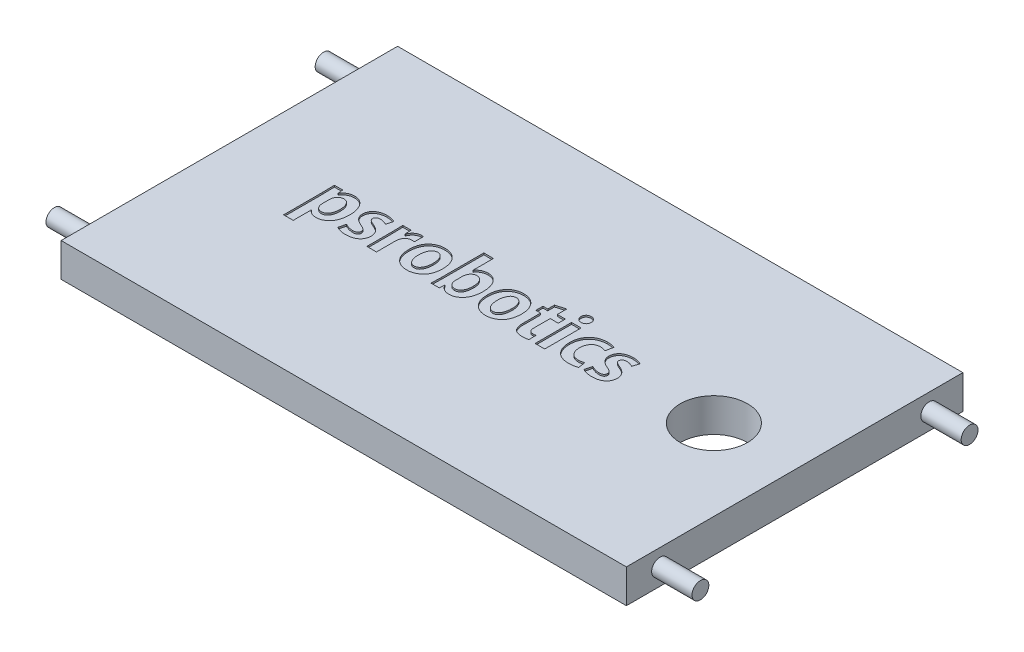
from build123d import *

# Parameters (mm, degrees)
SKETCH_1_W          = 168
SKETCH_1_H          = 100
EXTRUDE_1_DEPTH     = 10
SKETCH_2_R          = 2.5
EXTRUDE_2_DEPTH     = 12
EXTRUDE_START       = 12
SKETCH_3_R          = 2.5
EXTRUDE_3_DEPTH     = 12
SKETCH_4_R          = 10
CUT_EXTRUDE_1_DEPTH = 10
SKETCH_6_W          = 2.854406486
SKETCH_6_H          = 10.816518343
CUT_EXTRUDE_2_DEPTH = 0.5


with BuildPart() as part:
    # 草图1 → 凸台-拉伸1 (new body)
    with BuildSketch(Plane(origin=(0, 0, 0), x_dir=(1, 0, 0), z_dir=(0, 1, 0))):
        Rectangle(SKETCH_1_W, SKETCH_1_H)
    extrude(amount=EXTRUDE_1_DEPTH)

    # 草图2 → 凸台-拉伸2 (add)
    with BuildSketch(Plane.ZY.offset(84)):
        with Locations(Location((-40, 5, 0), (0, 0, 180))):
            Circle(SKETCH_2_R)
        with Locations(Location((40, 5, 0), (0, 0, 180))):
            Circle(SKETCH_2_R)
    extrude(amount=EXTRUDE_2_DEPTH)

    # 草图3 → 凸台-拉伸3 (add)
    with BuildSketch(Plane(origin=(84, 0, 0), x_dir=(0, 0, -1), z_dir=(1, 0, 0)).offset(EXTRUDE_START)):
        with Locations((-40, 5)):
            Circle(SKETCH_3_R)
        with Locations((40, 5)):
            Circle(SKETCH_3_R)
    extrude(amount=-EXTRUDE_3_DEPTH)

    # 草图4 → 切除-拉伸1 (cut)
    with BuildSketch(Plane(origin=(0, 10, 0), x_dir=(1, 0, 0), z_dir=(0, 1, 0))):
        with Locations(Location((60, 0, 0), (0, 0, 270))):
            Circle(SKETCH_4_R)
    extrude(amount=-CUT_EXTRUDE_1_DEPTH, mode=Mode.SUBTRACT)

    # 草图6 → 切除-拉伸2 (cut)
    # profile 1 of 11: a face of its own
    with BuildSketch(Plane(origin=(0, 10, 0), x_dir=(1, 0, 0), z_dir=(0, 1, 0))):
        with BuildLine():
            Line((-55.146102955, 4.84484548), (-57.634572767, 4.84484548))
            add(Edge.make_bspline(
                [(-57.634572767, 4.84484548), (-57.623966252, 4.587967633), (-57.6017651, 4.050280727), (-57.579946285, 3.204249915), (-57.566725529, 2.282686291), (-57.562102033, 1.642099097), (-57.559702503, 1.309643354)],
                knots=[0, 0, 0, 0, 0.872434831, 1.826147295, 2.87180102, 4, 4, 4, 4], degree=3))
            Line((-57.559702503, 1.309643354), (-57.556895795, -10.325331058))
            Line((-57.556895795, -10.325331058), (-54.702489308, -10.325331058))
            Line((-54.702489308, -10.325331058), (-54.702489308, -4.930150656))
            Line((-54.702489308, -4.930150656), (-54.663384692, -4.930150656))
            add(Edge.make_bspline(
                [(-54.663384692, -4.930150656), (-54.601309738, -5.021184105), (-54.475703882, -5.205386164), (-54.235616166, -5.447056322), (-53.956545152, -5.66016734), (-53.64640407, -5.852727572), (-53.299734659, -6.006912023), (-52.922114287, -6.119205332), (-52.514664988, -6.190542631), (-52.23234292, -6.202362093), (-52.086889027, -6.208451545)],
                knots=[0, 0, 0, 0, 0.880714621, 1.782086131, 2.711947099, 3.687971414, 4.6982148, 5.73955997, 6.83540878, 8, 8, 8, 8], degree=3))
            add(Edge.make_bspline(
                [(-52.086889027, -6.208451545), (-51.946196579, -6.204891175), (-51.667168075, -6.197830065), (-51.255184695, -6.134636526), (-50.856290682, -6.027954162), (-50.471937171, -5.873716887), (-50.098623707, -5.678903293), (-49.737872779, -5.438909097), (-49.392373978, -5.152834875), (-49.059423046, -4.826661531), (-48.747652471, -4.45511789), (-48.482127128, -4.025346462), (-48.250814624, -3.550009005), (-48.057153934, -3.026123236), (-47.906570745, -2.451869086), (-47.796899188, -1.829671549), (-47.719173064, -1.15884808), (-47.70185683, -0.694654663), (-47.692905312, -0.454692818)],
                knots=[0, 0, 0, 0, 0.833019025, 1.652086204, 2.462180915, 3.273926424, 4.100194538, 4.9525683, 5.835462923, 6.753389615, 7.710846528, 8.700498071, 9.737554625, 10.838085599, 12.00337457, 13.249274384, 14.578029827, 16, 16, 16, 16], degree=3))
            add(Edge.make_bspline(
                [(-47.692905312, -0.454692818), (-47.698729426, -0.24945429), (-47.710082113, 0.1506081), (-47.770211189, 0.734302373), (-47.861571988, 1.285520314), (-47.987411347, 1.804269024), (-48.14804649, 2.290043071), (-48.341258903, 2.745275316), (-48.572501019, 3.166706217), (-48.83280252, 3.555093388), (-49.121506339, 3.903791667), (-49.434449328, 4.208655254), (-49.767882257, 4.470491675), (-50.124017502, 4.684465052), (-50.500348602, 4.856311134), (-50.900683355, 4.974846018), (-51.320372055, 5.057461354), (-51.608880803, 5.070499121), (-51.755373632, 5.07711916)],
                knots=[0, 0, 0, 0, 1.287756241, 2.510166304, 3.677914371, 4.79081245, 5.855392705, 6.884510189, 7.888878388, 8.866584042, 9.813659286, 10.723557861, 11.602642665, 12.467156869, 13.324393567, 14.19046355, 15.081192111, 16, 16, 16, 16], degree=3))
            add(Edge.make_bspline(
                [(-51.755373632, 5.07711916), (-51.928027332, 5.070827076), (-52.265142094, 5.058541475), (-52.754171895, 4.973214679), (-53.208871772, 4.834210051), (-53.633973712, 4.650097689), (-54.020101342, 4.403672608), (-54.378034635, 4.112922805), (-54.702330218, 3.767455963), (-54.882869521, 3.503618975), (-54.975006201, 3.368972038)],
                knots=[0, 0, 0, 0, 1.086953167, 2.122329029, 3.114714223, 4.075679785, 5.029526715, 5.989188732, 6.973799774, 8, 8, 8, 8], degree=3))
            Line((-54.975006201, 3.368972038), (-55.011090106, 3.368983013))
            Line((-55.011090106, 3.368983013), (-55.146102955, 4.84484548))
        make_face()
        with BuildLine():
            add(Edge.make_bspline(
                [(-54.702489308, 0.41904691), (-54.694123519, 0.579035622), (-54.677910689, 0.88909241), (-54.560220502, 1.330928353), (-54.384636809, 1.733414812), (-54.17792372, 2.02815126), (-53.987291918, 2.235314332), (-53.832410406, 2.370595326), (-53.667706371, 2.485570099), (-53.497206889, 2.587383899), (-53.31170376, 2.657885305), (-53.1205299, 2.715390511), (-52.919807705, 2.752508688), (-52.782843617, 2.760757333), (-52.713396935, 2.76493975)],
                knots=[0, 0, 0, 0, 1.686726831, 3.268862506, 4.795218998, 6.300437724, 7.041767852, 7.763265046, 8.465273548, 9.160360029, 9.852277247, 10.552823157, 11.266219121, 12, 12, 12, 12], degree=3))
            add(Edge.make_bspline(
                [(-52.713396935, 2.76493975), (-52.627016457, 2.760493022), (-52.457645111, 2.751774057), (-52.212140339, 2.7031412), (-51.982435625, 2.627370617), (-51.769418556, 2.522688918), (-51.574940171, 2.388895071), (-51.394440472, 2.230264817), (-51.235740247, 2.039319692), (-51.089591792, 1.825992151), (-50.960939955, 1.590530184), (-50.852148729, 1.334666192), (-50.755322525, 1.063264856), (-50.681922228, 0.771998095), (-50.618116721, 0.465933832), (-50.577941149, 0.141774542), (-50.55170392, -0.199529323), (-50.548800021, -0.433100088), (-50.547309056, -0.553023656)],
                knots=[0, 0, 0, 0, 0.935867529, 1.835011164, 2.701048921, 3.549322375, 4.396139147, 5.25111747, 6.143369254, 7.077421111, 8.048836738, 9.043745302, 10.086321518, 11.16636512, 12.294263889, 13.470607517, 14.701319613, 16, 16, 16, 16], degree=3))
            add(Edge.make_bspline(
                [(-50.547309056, -0.553023656), (-50.548943637, -0.673864441), (-50.552140517, -0.910202312), (-50.576558347, -1.255625657), (-50.622576383, -1.583718128), (-50.682931903, -1.894638611), (-50.762829149, -2.18904017), (-50.856149771, -2.46735785), (-50.97296818, -2.726807509), (-51.103821621, -2.968252959), (-51.250561589, -3.188140527), (-51.419112112, -3.378420366), (-51.602036614, -3.542844587), (-51.802568973, -3.679811198), (-52.022532706, -3.783085804), (-52.256552525, -3.863657765), (-52.509395828, -3.910429616), (-52.683255584, -3.921500133), (-52.772395438, -3.927176112)],
                knots=[0, 0, 0, 0, 1.283057567, 2.509377056, 3.673742815, 4.798940461, 5.869887558, 6.910729667, 7.912262172, 8.886775332, 9.82447372, 10.712177734, 11.578403903, 12.43059094, 13.280047066, 14.15105402, 15.052024584, 16, 16, 16, 16], degree=3))
            add(Edge.make_bspline(
                [(-52.772395438, -3.927176112), (-52.8959997, -3.921666686), (-53.140846429, -3.910753106), (-53.491748406, -3.793245235), (-53.82047427, -3.613207704), (-54.06527619, -3.402591591), (-54.243062951, -3.202149989), (-54.358694824, -3.027053097), (-54.460349507, -2.835558474), (-54.544760692, -2.624713464), (-54.607737202, -2.394276279), (-54.659892525, -2.14692862), (-54.688714671, -1.879672654), (-54.697812348, -1.695585483), (-54.702489308, -1.60094944)],
                knots=[0, 0, 0, 0, 1.310090046, 2.595147259, 3.892303463, 5.277140479, 6.004146831, 6.736115741, 7.502375817, 8.306837944, 9.145406286, 10.039943247, 10.992368591, 12, 12, 12, 12], degree=3))
            Line((-54.702489308, -1.60094944), (-54.702489308, 0.41904691))
        make_face(mode=Mode.SUBTRACT)
    # profile 2 of 11: a face of its own
    with BuildSketch(Plane(origin=(0, 10, 0), x_dir=(1, 0, 0), z_dir=(0, 1, 0))):
        with BuildLine():
            add(Edge.make_bspline(
                [(-46.3018285, -5.481818481), (-46.207573439, -5.537115402), (-46.012966911, -5.651285843), (-45.690343166, -5.782928621), (-45.34288352, -5.909897871), (-44.96668849, -6.013400327), (-44.569488644, -6.1015059), (-44.156379406, -6.162366506), (-43.730376488, -6.199360996), (-43.442278373, -6.205391816), (-43.296112145, -6.208451545)],
                knots=[0, 0, 0, 0, 0.83761196, 1.729400559, 2.668252281, 3.676193025, 4.720774259, 5.789020092, 6.87826204, 8, 8, 8, 8], degree=3))
            add(Edge.make_bspline(
                [(-43.296112145, -6.208451545), (-43.13023167, -6.204089282), (-42.80808816, -6.195617671), (-42.339715674, -6.147013612), (-41.900999275, -6.072445969), (-41.491942705, -5.969084067), (-41.112948423, -5.836679905), (-40.76318043, -5.677133311), (-40.44351928, -5.488352539), (-40.155369784, -5.271200692), (-39.901045715, -5.029259557), (-39.674764899, -4.770321817), (-39.489881, -4.485784031), (-39.333705975, -4.184305356), (-39.212079718, -3.86087702), (-39.126355475, -3.517713557), (-39.071091951, -3.154461856), (-39.063401251, -2.90567694), (-39.05945777, -2.778110039)],
                knots=[0, 0, 0, 0, 1.294448016, 2.513846346, 3.670773034, 4.764320961, 5.802019244, 6.79930617, 7.759297293, 8.693207164, 9.608170021, 10.494314425, 11.369880064, 12.249036721, 13.139389433, 14.05924175, 15.004857203, 16, 16, 16, 16], degree=3))
            add(Edge.make_bspline(
                [(-39.05945777, -2.778110039), (-39.059692717, -2.688143549), (-39.060154098, -2.511470161), (-39.089014716, -2.249902515), (-39.141382675, -1.998087415), (-39.205252242, -1.751575725), (-39.302524263, -1.51823418), (-39.409256617, -1.2893969), (-39.543318307, -1.071758849), (-39.699514443, -0.863914949), (-39.872497811, -0.661453957), (-40.068326028, -0.469198148), (-40.285248258, -0.287344759), (-40.522157311, -0.112062115), (-40.781036627, 0.052666201), (-41.060234758, 0.210687763), (-41.360603871, 0.359318016), (-41.570655694, 0.449084655), (-41.677867503, 0.494902128)],
                knots=[0, 0, 0, 0, 0.962486949, 1.890101854, 2.810103424, 3.714741646, 4.610057768, 5.511190598, 6.415440003, 7.339636668, 8.292049338, 9.263110372, 10.273172223, 11.319680428, 12.415205866, 13.555314351, 14.752216631, 16, 16, 16, 16], degree=3))
            add(Edge.make_bspline(
                [(-41.677867503, 0.494902128), (-41.824470059, 0.555481815), (-42.095726949, 0.667571658), (-42.465114637, 0.840741044), (-42.762145419, 1.008700875), (-43.00022991, 1.164698384), (-43.173978575, 1.333493736), (-43.297160029, 1.513736943), (-43.36904449, 1.713659859), (-43.372855793, 1.852250007), (-43.374776815, 1.922103999)],
                knots=[0, 0, 0, 0, 1.614286799, 2.986894832, 4.147698299, 5.086165248, 5.874638583, 6.596229827, 7.29245366, 8, 8, 8, 8], degree=3))
            add(Edge.make_bspline(
                [(-43.374776815, 1.922103999), (-43.370377079, 1.992815058), (-43.3617347, 2.13171243), (-43.295585252, 2.330305232), (-43.18137361, 2.506378686), (-43.024565877, 2.659672006), (-42.823738798, 2.782929108), (-42.583868017, 2.877520054), (-42.301621754, 2.927060259), (-42.101321839, 2.936787964), (-41.995335636, 2.941935258)],
                knots=[0, 0, 0, 0, 0.881322943, 1.731178161, 2.577168917, 3.477799905, 4.443891127, 5.498430146, 6.676325488, 8, 8, 8, 8], degree=3))
            add(Edge.make_bspline(
                [(-41.995335636, 2.941935258), (-41.895090203, 2.937300515), (-41.696917337, 2.928138201), (-41.405712784, 2.897644433), (-41.128000517, 2.834796926), (-40.862743811, 2.761668942), (-40.616063022, 2.668629612), (-40.385151541, 2.582408793), (-40.178688608, 2.48551649), (-40.050889173, 2.416208309), (-39.989386549, 2.38285421)],
                knots=[0, 0, 0, 0, 1.145139439, 2.263799542, 3.334746207, 4.390066399, 5.400675127, 6.341237668, 7.2017317, 8, 8, 8, 8], degree=3))
            Line((-39.989386549, 2.38285421), (-39.457812894, 4.328339709))
            add(Edge.make_bspline(
                [(-39.457812894, 4.328339709), (-39.539067997, 4.367203566), (-39.707563869, 4.447794191), (-39.978457958, 4.554958098), (-40.276801527, 4.648326424), (-40.598308743, 4.736777653), (-40.943642671, 4.806663518), (-41.310675136, 4.855639701), (-41.696838561, 4.891522596), (-41.961535277, 4.89535862), (-42.096475926, 4.8973142)],
                knots=[0, 0, 0, 0, 0.793782206, 1.646038456, 2.564925853, 3.548079898, 4.584144923, 5.667469512, 6.810891258, 8, 8, 8, 8], degree=3))
            add(Edge.make_bspline(
                [(-42.096475926, 4.8973142), (-42.245543248, 4.893207653), (-42.537041963, 4.885177368), (-42.961129586, 4.832277745), (-43.360404353, 4.757917518), (-43.736074955, 4.656730937), (-44.086454317, 4.525809975), (-44.41133563, 4.364356813), (-44.711997139, 4.177868882), (-44.986621546, 3.965695284), (-45.231052324, 3.728866501), (-45.446006548, 3.474994968), (-45.630311836, 3.204555539), (-45.780139525, 2.914664382), (-45.898381402, 2.608568438), (-45.982474028, 2.284238531), (-46.036696104, 1.944461298), (-46.046970147, 1.711595951), (-46.05218505, 1.593398056)],
                knots=[0, 0, 0, 0, 1.238305518, 2.421486237, 3.5461187, 4.61066152, 5.649707088, 6.648348897, 7.619889882, 8.584803378, 9.525735187, 10.442256057, 11.344296488, 12.23865353, 13.147513515, 14.064694656, 15.017676866, 16, 16, 16, 16], degree=3))
            add(Edge.make_bspline(
                [(-46.05218505, 1.593398056), (-46.046601535, 1.445632764), (-46.035444536, 1.150367635), (-45.915160688, 0.713622981), (-45.718966083, 0.290122783), (-45.491682121, -0.048048694), (-45.269111075, -0.308856033), (-45.06916273, -0.499618935), (-44.848222101, -0.689491511), (-44.595019116, -0.868146296), (-44.319023843, -1.044514694), (-44.015705352, -1.213578557), (-43.68670984, -1.376970816), (-43.454888357, -1.476580636), (-43.33544448, -1.527903675)],
                knots=[0, 0, 0, 0, 1.205031059, 2.40789731, 3.671482689, 5.006580914, 5.722947508, 6.46981472, 7.262559811, 8.101501413, 8.999551731, 9.938382947, 10.93777087, 12, 12, 12, 12], degree=3))
            add(Edge.make_bspline(
                [(-43.33544448, -1.527903675), (-43.196091014, -1.585169607), (-42.936629787, -1.69179264), (-42.586592778, -1.865184665), (-42.303220462, -2.035172276), (-42.079960583, -2.204164581), (-41.919406112, -2.387866922), (-41.804101597, -2.583796607), (-41.740575919, -2.801351887), (-41.738113062, -2.951914582), (-41.736866006, -3.028151311)],
                knots=[0, 0, 0, 0, 1.539706787, 2.866769117, 3.98803217, 4.914911995, 5.715441686, 6.465811877, 7.223170887, 8, 8, 8, 8], degree=3))
            add(Edge.make_bspline(
                [(-41.736866006, -3.028151311), (-41.740510269, -3.10740313), (-41.747527952, -3.260016709), (-41.821501702, -3.476916294), (-41.945262713, -3.66489668), (-42.116325887, -3.826893912), (-42.337605071, -3.95354286), (-42.608093698, -4.041170633), (-42.925792571, -4.097303785), (-43.154432932, -4.103613772), (-43.276445977, -4.106981073)],
                knots=[0, 0, 0, 0, 0.894036243, 1.721627017, 2.5562417, 3.418119501, 4.363067525, 5.415159204, 6.6206097, 8, 8, 8, 8], degree=3))
            add(Edge.make_bspline(
                [(-43.276445977, -4.106981073), (-43.390848639, -4.102260759), (-43.61951598, -4.092825825), (-43.962028194, -4.045372019), (-44.305337291, -3.976736695), (-44.641672659, -3.877359678), (-44.963136489, -3.767293154), (-45.257820992, -3.648666495), (-45.524094793, -3.530225248), (-45.6856777, -3.439498977), (-45.762811443, -3.396189589)],
                knots=[0, 0, 0, 0, 1.051998463, 2.102728099, 3.174823593, 4.267460494, 5.323782618, 6.297336217, 7.187210868, 8, 8, 8, 8], degree=3))
            Line((-45.762811443, -3.396189589), (-46.3018285, -5.481818481))
        make_face()
    # profile 3 of 11: a face of its own
    with BuildSketch(Plane(origin=(0, 10, 0), x_dir=(1, 0, 0), z_dir=(0, 1, 0))):
        with BuildLine():
            Line((-34.571187293, 2.832536714), (-34.686912592, 4.672558))
            Line((-34.686912592, 4.672558), (-37.136807303, 4.672558))
            add(Edge.make_bspline(
                [(-37.136807303, 4.672558), (-37.127486042, 4.428144717), (-37.108166626, 3.921569306), (-37.088236377, 3.276294329), (-37.071301934, 2.728489485), (-37.068262616, 2.289195983), (-37.060223857, 1.826606108), (-37.061355915, 1.510991545), (-37.06193704, 1.348975689)],
                knots=[0, 0, 0, 0, 1.324207679, 2.744576904, 3.495229973, 4.291304775, 5.122867722, 6, 6, 6, 6], degree=3))
            Line((-37.06193704, 1.348975689), (-37.059130331, -6.085916616))
            Line((-37.059130331, -6.085916616), (-34.204723844, -6.085916616))
            Line((-34.204723844, -6.085916616), (-34.204723844, -0.493174636))
            add(Edge.make_bspline(
                [(-34.204723844, -0.493174636), (-34.201568548, -0.38192841), (-34.195448005, -0.16613659), (-34.161472684, 0.146284551), (-34.108734386, 0.436631196), (-34.036579012, 0.7050733), (-33.942138646, 0.950468751), (-33.835617743, 1.177632806), (-33.700123463, 1.377618457), (-33.552267528, 1.559244171), (-33.385743235, 1.714894958), (-33.209818102, 1.852833401), (-33.021190328, 1.966589958), (-32.82300244, 2.064700111), (-32.61135898, 2.137347313), (-32.388807826, 2.186534053), (-32.155759027, 2.219723637), (-31.996615241, 2.221701394), (-31.915020054, 2.222715417)],
                knots=[0, 0, 0, 0, 1.328993375, 2.577938255, 3.749595128, 4.851401761, 5.892294362, 6.887899519, 7.84040204, 8.769965346, 9.679936652, 10.557066843, 11.435764995, 12.306307666, 13.19428498, 14.100673707, 15.026189549, 16, 16, 16, 16], degree=3))
            add(Edge.make_bspline(
                [(-31.915020054, 2.222715417), (-31.781789479, 2.221178059), (-31.534233283, 2.21832149), (-31.289264675, 2.18288947), (-31.176134046, 2.166526367)],
                knots=[0, 0, 0, 0, 1.076366321, 2, 2, 2, 2], degree=3))
            Line((-31.176134046, 2.166526367), (-31.175321939, 4.843281624))
            add(Edge.make_bspline(
                [(-31.175321939, 4.843281624), (-31.27276079, 4.860091791), (-31.484897986, 4.896689734), (-31.700251742, 4.897095052), (-31.816689217, 4.8973142)],
                knots=[0, 0, 0, 0, 0.918639949, 2, 2, 2, 2], degree=3))
            add(Edge.make_bspline(
                [(-31.816689217, 4.8973142), (-31.947393181, 4.890287078), (-32.210336499, 4.876150287), (-32.601077428, 4.776726217), (-32.983613081, 4.609107659), (-33.358785504, 4.383515256), (-33.711257218, 4.092321762), (-34.019535811, 3.730256879), (-34.290073554, 3.309663704), (-34.424656947, 2.994816949), (-34.494097452, 2.83236661)],
                knots=[0, 0, 0, 0, 0.873024494, 1.756304479, 2.675727742, 3.655517484, 4.673026258, 5.715548879, 6.821300036, 8, 8, 8, 8], degree=3))
            Line((-34.494097452, 2.83236661), (-34.571187293, 2.832536714))
        make_face()
    # profile 4 of 11: a face of its own
    with BuildSketch(Plane(origin=(0, 10, 0), x_dir=(1, 0, 0), z_dir=(0, 1, 0))):
        with BuildLine():
            add(Edge.make_bspline(
                [(-24.924073374, 5.070682661), (-25.109146398, 5.065012548), (-25.471972581, 5.053896582), (-26.001968875, 4.979446465), (-26.503852102, 4.861046303), (-26.981253388, 4.702326703), (-27.427897949, 4.48924872), (-27.850124981, 4.235052866), (-28.245782493, 3.935838319), (-28.610746997, 3.590382334), (-28.940020123, 3.201014419), (-29.231323891, 2.772738185), (-29.4766429, 2.301737569), (-29.677452398, 1.791799042), (-29.839504203, 1.243071754), (-29.950902385, 0.652770463), (-30.029701303, 0.024015112), (-30.042819592, -0.40948867), (-30.049543592, -0.631688326)],
                knots=[0, 0, 0, 0, 1.027541305, 2.01444209, 2.965455667, 3.887964877, 4.802126615, 5.70729655, 6.620422444, 7.551044475, 8.491838489, 9.446611953, 10.4211747, 11.434103498, 12.48554143, 13.593051636, 14.766278128, 16, 16, 16, 16], degree=3))
            add(Edge.make_bspline(
                [(-30.049543592, -0.631688326), (-30.04220898, -0.847268187), (-30.0279165, -1.26735456), (-29.957654371, -1.878013311), (-29.846348104, -2.451540454), (-29.691232465, -2.987143449), (-29.498748821, -3.487036487), (-29.261962009, -3.948020689), (-28.981802077, -4.369960281), (-28.661585813, -4.751831484), (-28.306136059, -5.092181563), (-27.924177684, -5.391484474), (-27.512511866, -5.644701879), (-27.071997709, -5.848072493), (-26.605547824, -6.014756958), (-26.109043294, -6.125767586), (-25.586782701, -6.203132112), (-25.228820371, -6.212230702), (-25.045908684, -6.216879902)],
                knots=[0, 0, 0, 0, 1.223897542, 2.384929084, 3.484665604, 4.536017932, 5.545769523, 6.520427524, 7.47127239, 8.414510255, 9.343031883, 10.259533357, 11.163839298, 12.079307538, 13.00892387, 13.969450143, 14.96242909, 16, 16, 16, 16], degree=3))
            add(Edge.make_bspline(
                [(-25.045908684, -6.216879902), (-24.887499491, -6.215135633), (-24.573366557, -6.211676663), (-24.108097028, -6.154908221), (-23.656653984, -6.051415615), (-23.216643363, -5.913208722), (-22.791337123, -5.724148883), (-22.379441441, -5.49334478), (-21.977884299, -5.222315096), (-21.592933588, -4.90883501), (-21.233025658, -4.547704002), (-20.919046506, -4.126563474), (-20.653018659, -3.651484404), (-20.429949987, -3.123889511), (-20.254319288, -2.54251079), (-20.125084555, -1.907521064), (-20.032611868, -1.220422034), (-20.01305343, -0.743440704), (-20.002941441, -0.496834606)],
                knots=[0, 0, 0, 0, 0.884174072, 1.753359075, 2.610998878, 3.46768153, 4.324683351, 5.204936043, 6.101305348, 7.026692402, 7.9733639, 8.940823434, 9.950119057, 11.006907355, 12.133439191, 13.335476165, 14.622403465, 16, 16, 16, 16], degree=3))
            add(Edge.make_bspline(
                [(-20.002941441, -0.496834606), (-20.008338441, -0.292498878), (-20.018862681, 0.105959152), (-20.085113311, 0.688164996), (-20.187526276, 1.238899808), (-20.330240046, 1.759489327), (-20.516565535, 2.247305888), (-20.741640703, 2.704901175), (-21.007082313, 3.131169095), (-21.309560818, 3.525090179), (-21.649716178, 3.879275636), (-22.021812741, 4.190831865), (-22.427709644, 4.454374141), (-22.865597731, 4.670642594), (-23.335144621, 4.843928811), (-23.837833735, 4.965168983), (-24.37103245, 5.045735307), (-24.737510834, 5.060918761), (-24.925102226, 5.068690803)],
                knots=[0, 0, 0, 0, 1.172178488, 2.285767329, 3.357353606, 4.383142343, 5.37790515, 6.348569651, 7.304145378, 8.254071287, 9.192580156, 10.115693567, 11.032123006, 11.961934424, 12.912057809, 13.897126048, 14.92358985, 16, 16, 16, 16], degree=3))
            Line((-24.925102226, 5.068690803), (-24.924073374, 5.070682661))
        make_face()
        with BuildLine():
            add(Edge.make_bspline(
                [(-22.854538475, -0.553081272), (-22.856903184, -0.675807922), (-22.861512816, -0.915044414), (-22.891410629, -1.265499989), (-22.931950115, -1.599611209), (-22.990973916, -1.919805686), (-23.069032018, -2.22487258), (-23.165941707, -2.515006691), (-23.273601172, -2.791733112), (-23.402548503, -3.049306563), (-23.547473897, -3.285006269), (-23.707232605, -3.494301504), (-23.882545461, -3.674130037), (-24.075356608, -3.822185157), (-24.286159601, -3.938115746), (-24.511769776, -4.025503962), (-24.752901814, -4.083270196), (-24.919170111, -4.095261188), (-25.003766896, -4.101362168)],
                knots=[0, 0, 0, 0, 1.283122856, 2.501248181, 3.675693063, 4.801111487, 5.90306991, 6.965153204, 7.997944625, 9.005120804, 9.972479457, 10.88710922, 11.752618092, 12.590832926, 13.419210094, 14.259310164, 15.114342493, 16, 16, 16, 16], degree=3))
            add(Edge.make_bspline(
                [(-25.003766896, -4.101362168), (-25.091109267, -4.095013038), (-25.261695927, -4.082612679), (-25.510006746, -4.029031196), (-25.740410321, -3.94162897), (-25.954093498, -3.824055837), (-26.152913467, -3.680287614), (-26.333714956, -3.503719754), (-26.497399694, -3.296671514), (-26.641749806, -3.060572004), (-26.768540826, -2.802356893), (-26.885051744, -2.53045043), (-26.981612893, -2.241218468), (-27.054393184, -1.935908052), (-27.117862693, -1.616637418), (-27.162520098, -1.282681067), (-27.187610385, -0.932694231), (-27.190733695, -0.694473363), (-27.192330396, -0.572689824)],
                knots=[0, 0, 0, 0, 0.911055033, 1.779363595, 2.63415358, 3.467599306, 4.312094286, 5.180950159, 6.090072498, 7.053374358, 8.056326761, 9.083167907, 10.131542306, 11.226494184, 12.349015479, 13.51979452, 14.732066572, 16, 16, 16, 16], degree=3))
            add(Edge.make_bspline(
                [(-27.192330396, -0.572689824), (-27.18860646, -0.359796389), (-27.181270747, 0.05957848), (-27.089581617, 0.673407785), (-26.93392501, 1.258915091), (-26.751983995, 1.720137252), (-26.571147884, 2.062014415), (-26.409443776, 2.28500502), (-26.228420122, 2.480271504), (-26.022176219, 2.640662965), (-25.793762171, 2.769027327), (-25.543797806, 2.864193885), (-25.2719705, 2.930837454), (-25.081884759, 2.945586073), (-24.984100729, 2.953173068)],
                knots=[0, 0, 0, 0, 1.65391609, 3.258018954, 4.81028456, 6.355517439, 7.101557024, 7.81077486, 8.490611841, 9.164890731, 9.833129237, 10.519947043, 11.238630196, 12, 12, 12, 12], degree=3))
            add(Edge.make_bspline(
                [(-24.984100729, 2.953173068), (-24.892886091, 2.945386979), (-24.716009701, 2.930288795), (-24.461913267, 2.866305618), (-24.227066364, 2.773877082), (-24.010054456, 2.649273427), (-23.816102529, 2.489618552), (-23.639096357, 2.301135591), (-23.482135245, 2.082050881), (-23.303113324, 1.745190504), (-23.121176702, 1.287887343), (-22.961615427, 0.70387801), (-22.871795493, 0.084737601), (-22.86223163, -0.339220847), (-22.857345184, -0.555833109)],
                knots=[0, 0, 0, 0, 0.723780441, 1.403499192, 2.065726992, 2.716821306, 3.375678756, 4.047057085, 4.75896833, 5.502158925, 7.062054522, 8.644794005, 10.285731159, 12, 12, 12, 12], degree=3))
            Line((-22.857345184, -0.555833109), (-22.854538475, -0.553081272))
        make_face(mode=Mode.SUBTRACT)
    # profile 5 of 11: a face of its own
    with BuildSketch(Plane(origin=(0, 10, 0), x_dir=(1, 0, 0), z_dir=(0, 1, 0))):
        with BuildLine():
            Line((-15.145398063, 9.631688876), (-17.99980455, 9.631688876))
            Line((-17.99980455, 9.631688876), (-17.99980455, -2.889950392))
            add(Edge.make_bspline(
                [(-17.99980455, -2.889950392), (-18.001958302, -3.172020573), (-18.006236163, -3.732278585), (-18.021139662, -4.426369049), (-18.035072333, -4.962063273), (-18.050008368, -5.333790657), (-18.063716333, -5.676558399), (-18.0736916, -5.895669717), (-18.078466476, -6.00055206)],
                knots=[0, 0, 0, 0, 1.631623893, 3.240790478, 4.015719323, 4.731271361, 5.392695757, 6, 6, 6, 6], degree=3))
            Line((-18.078466476, -6.00055206), (-15.64687436, -5.999937492))
            Line((-15.64687436, -5.999937492), (-15.511861511, -4.504655782))
            Line((-15.511861511, -4.504655782), (-15.453998861, -4.504655782))
            add(Edge.make_bspline(
                [(-15.453998861, -4.504655782), (-15.367056837, -4.649066011), (-15.19942851, -4.927495751), (-14.894970295, -5.290412669), (-14.563433337, -5.591636869), (-14.199220599, -5.826013581), (-13.811664966, -6.003922518), (-13.402293886, -6.127682991), (-12.97274701, -6.202916978), (-12.679007555, -6.210313344), (-12.529797782, -6.21407045)],
                knots=[0, 0, 0, 0, 1.131380875, 2.181355746, 3.170752353, 4.130871389, 5.079890649, 6.027531582, 6.998052322, 8, 8, 8, 8], degree=3))
            add(Edge.make_bspline(
                [(-12.529797782, -6.21407045), (-12.387242459, -6.209475186), (-12.104411307, -6.200358137), (-11.687098392, -6.135871377), (-11.284379233, -6.021166593), (-10.895583406, -5.864146576), (-10.520921859, -5.658859695), (-10.16207814, -5.408182797), (-9.816580628, -5.112101571), (-9.485823031, -4.774715894), (-9.180582258, -4.388599322), (-8.913670692, -3.953639637), (-8.685502963, -3.470946871), (-8.49518439, -2.94329717), (-8.347497652, -2.367174161), (-8.236133315, -1.746546968), (-8.163228905, -1.078086983), (-8.145146963, -0.616884655), (-8.135814067, -0.378837601)],
                knots=[0, 0, 0, 0, 0.838392905, 1.663379705, 2.475971964, 3.296293461, 4.124491874, 4.983210998, 5.866229662, 6.797166972, 7.758061466, 8.75472666, 9.791965596, 10.893148678, 12.048777793, 13.28585033, 14.599106523, 16, 16, 16, 16], degree=3))
            add(Edge.make_bspline(
                [(-8.135814067, -0.378837601), (-8.140978203, -0.178314136), (-8.151034995, 0.212191232), (-8.204616111, 0.782875404), (-8.291130535, 1.32156919), (-8.408662724, 1.830921134), (-8.559816206, 2.309549192), (-8.744888934, 2.757127326), (-8.963137316, 3.173026281), (-9.208125575, 3.557390856), (-9.482877775, 3.904105612), (-9.784757103, 4.206483022), (-10.109724296, 4.464388531), (-10.458290757, 4.678009341), (-10.832184037, 4.843211136), (-11.227344273, 4.968456207), (-11.647560909, 5.045340677), (-11.93575042, 5.058932285), (-12.083094834, 5.06588135)],
                knots=[0, 0, 0, 0, 1.28131298, 2.495267064, 3.658931251, 4.76484831, 5.832085595, 6.862128514, 7.85502597, 8.829269738, 9.770241519, 10.675634193, 11.55307539, 12.415039348, 13.280133321, 14.158186302, 15.058324646, 16, 16, 16, 16], degree=3))
            add(Edge.make_bspline(
                [(-12.083094834, 5.06588135), (-12.251002124, 5.060115166), (-12.576422975, 5.048939733), (-13.047813292, 4.97328481), (-13.482806827, 4.843759573), (-13.882917523, 4.665404002), (-14.24542354, 4.44288739), (-14.574225493, 4.181034454), (-14.865207608, 3.877250968), (-15.027371652, 3.647428757), (-15.10887518, 3.531920284)],
                knots=[0, 0, 0, 0, 1.137196293, 2.203998325, 3.223492524, 4.203095137, 5.162612269, 6.096781389, 7.043443732, 8, 8, 8, 8], degree=3))
            Line((-15.10887518, 3.531920284), (-15.145398063, 3.534046578))
            Line((-15.145398063, 3.534046578), (-15.145398063, 9.631688876))
        make_face()
        with BuildLine():
            add(Edge.make_bspline(
                [(-15.145398063, 0.440123291), (-15.14078658, 0.526818437), (-15.131812355, 0.695532424), (-15.101778156, 0.942474443), (-15.051152867, 1.1754946), (-14.982970444, 1.394820537), (-14.902875962, 1.602311179), (-14.800494547, 1.793622519), (-14.682358223, 1.971847826), (-14.504674127, 2.185270848), (-14.258272103, 2.41195308), (-13.929521608, 2.619166207), (-13.570283893, 2.744207981), (-13.321110403, 2.765470652), (-13.195638026, 2.77617756)],
                knots=[0, 0, 0, 0, 0.926973479, 1.803946349, 2.653285131, 3.46941656, 4.254951615, 5.024407706, 5.781613554, 6.534514615, 7.985556617, 9.337145824, 10.65910838, 12, 12, 12, 12], degree=3))
            add(Edge.make_bspline(
                [(-13.195638026, 2.77617756), (-13.105442048, 2.771025134), (-12.930228534, 2.761016098), (-12.677292423, 2.707315815), (-12.439474679, 2.634471711), (-12.222189229, 2.525591459), (-12.022291344, 2.39127667), (-11.838628585, 2.231083772), (-11.674801324, 2.039928839), (-11.52991599, 1.822898814), (-11.401512631, 1.585598683), (-11.293348366, 1.330522317), (-11.194978344, 1.062561304), (-11.121584219, 0.77601292), (-11.062207206, 0.474932672), (-11.020516237, 0.158715972), (-10.994763118, -0.173315204), (-10.991756455, -0.400328048), (-10.990217811, -0.516500774)],
                knots=[0, 0, 0, 0, 0.976076565, 1.896113425, 2.790116899, 3.660142464, 4.514449837, 5.390414213, 6.288313643, 7.229749571, 8.209028891, 9.202876975, 10.225239958, 11.294334228, 12.39917788, 13.544132677, 14.743221774, 16, 16, 16, 16], degree=3))
            add(Edge.make_bspline(
                [(-10.990217811, -0.516500774), (-10.993102532, -0.645750054), (-10.998710107, -0.8969961), (-11.021192077, -1.264249015), (-11.071278044, -1.607844527), (-11.13040811, -1.931620405), (-11.214516155, -2.231682114), (-11.305445606, -2.51450338), (-11.427353451, -2.770389866), (-11.556931104, -3.007486972), (-11.705724992, -3.219595496), (-11.873388577, -3.403779272), (-12.055046426, -3.562603146), (-12.255159801, -3.689281417), (-12.467400067, -3.793052612), (-12.69692533, -3.863975995), (-12.940570966, -3.915211695), (-13.109199551, -3.921264177), (-13.195638026, -3.92436666)],
                knots=[0, 0, 0, 0, 1.364917333, 2.653245589, 3.88085136, 5.028713805, 6.124739769, 7.168976952, 8.159854234, 9.111483112, 10.019432624, 10.88731207, 11.735541447, 12.558266628, 13.380754164, 14.221808758, 15.088504847, 16, 16, 16, 16], degree=3))
            add(Edge.make_bspline(
                [(-13.195638026, -3.92436666), (-13.266939304, -3.92001672), (-13.406508496, -3.911501899), (-13.610827664, -3.877321339), (-13.804412525, -3.825095446), (-13.986752671, -3.750288061), (-14.158842091, -3.657972753), (-14.318910556, -3.544390334), (-14.469619767, -3.414576426), (-14.652171741, -3.215092547), (-14.847998639, -2.932520639), (-15.018220822, -2.55069235), (-15.1209375, -2.129683531), (-15.137068201, -1.836587319), (-15.145398063, -1.685233015)],
                knots=[0, 0, 0, 0, 0.777325877, 1.521582024, 2.25130851, 2.955661787, 3.662813928, 4.372827115, 5.088382805, 5.824351233, 7.312060107, 8.809069102, 10.352209605, 12, 12, 12, 12], degree=3))
            Line((-15.145398063, -1.685233015), (-15.145398063, 0.440123291))
        make_face(mode=Mode.SUBTRACT)
    # profile 6 of 11: a face of its own
    with BuildSketch(Plane(origin=(0, 10, 0), x_dir=(1, 0, 0), z_dir=(0, 1, 0))):
        with BuildLine():
            add(Edge.make_bspline(
                [(-1.549428548, 5.070682661), (-1.734501572, 5.065012548), (-2.097327754, 5.053896582), (-2.627324049, 4.979446465), (-3.129207275, 4.861046303), (-3.606608561, 4.702326703), (-4.053253123, 4.48924872), (-4.475480154, 4.235052866), (-4.871137667, 3.935838319), (-5.236102171, 3.590382334), (-5.565375297, 3.201014419), (-5.856679064, 2.772738185), (-6.101998073, 2.301737569), (-6.302807571, 1.791799042), (-6.464859377, 1.243071754), (-6.576257559, 0.652770463), (-6.655056476, 0.024015112), (-6.668174766, -0.40948867), (-6.674898766, -0.631688326)],
                knots=[0, 0, 0, 0, 1.027541305, 2.01444209, 2.965455667, 3.887964877, 4.802126615, 5.70729655, 6.620422444, 7.551044475, 8.491838489, 9.446611953, 10.4211747, 11.434103498, 12.48554143, 13.593051636, 14.766278128, 16, 16, 16, 16], degree=3))
            add(Edge.make_bspline(
                [(-6.674898766, -0.631688326), (-6.667564153, -0.847268187), (-6.653271673, -1.26735456), (-6.583009544, -1.878013311), (-6.471703278, -2.451540454), (-6.316587639, -2.987143449), (-6.124103995, -3.487036487), (-5.887317182, -3.948020689), (-5.60715725, -4.369960281), (-5.286940986, -4.751831484), (-4.931491233, -5.092181563), (-4.549532858, -5.391484474), (-4.137867039, -5.644701879), (-3.697352883, -5.848072493), (-3.230902997, -6.014756958), (-2.734398468, -6.125767586), (-2.212137875, -6.203132112), (-1.854175545, -6.212230702), (-1.671263857, -6.216879902)],
                knots=[0, 0, 0, 0, 1.223897542, 2.384929084, 3.484665604, 4.536017932, 5.545769523, 6.520427524, 7.47127239, 8.414510255, 9.343031883, 10.259533357, 11.163839298, 12.079307538, 13.00892387, 13.969450143, 14.96242909, 16, 16, 16, 16], degree=3))
            add(Edge.make_bspline(
                [(-1.671263857, -6.216879902), (-1.512854665, -6.215135633), (-1.198721731, -6.211676663), (-0.733452202, -6.154908221), (-0.282009157, -6.051415615), (0.158001463, -5.913208722), (0.583307703, -5.724148883), (0.995203385, -5.49334478), (1.396760528, -5.222315096), (1.781711238, -4.90883501), (2.141619169, -4.547704002), (2.455598321, -4.126563474), (2.721626167, -3.651484404), (2.94469484, -3.123889511), (3.120325538, -2.54251079), (3.249560272, -1.907521064), (3.342032958, -1.220422034), (3.361591396, -0.743440704), (3.371703386, -0.496834606)],
                knots=[0, 0, 0, 0, 0.884174072, 1.753359075, 2.610998878, 3.46768153, 4.324683351, 5.204936043, 6.101305348, 7.026692402, 7.9733639, 8.940823434, 9.950119057, 11.006907355, 12.133439191, 13.335476165, 14.622403465, 16, 16, 16, 16], degree=3))
            add(Edge.make_bspline(
                [(3.371703386, -0.496834606), (3.366306385, -0.292498878), (3.355782145, 0.105959152), (3.289531515, 0.688164996), (3.187118551, 1.238899808), (3.04440478, 1.759489327), (2.858079291, 2.247305888), (2.633004124, 2.704901175), (2.367562513, 3.131169095), (2.065084008, 3.525090179), (1.724928648, 3.879275636), (1.352832086, 4.190831865), (0.946935182, 4.454374141), (0.509047095, 4.670642594), (0.039500205, 4.843928811), (-0.463188908, 4.965168983), (-0.996387623, 5.045735307), (-1.362866008, 5.060918761), (-1.5504574, 5.068690803)],
                knots=[0, 0, 0, 0, 1.172178488, 2.285767329, 3.357353606, 4.383142343, 5.37790515, 6.348569651, 7.304145378, 8.254071287, 9.192580156, 10.115693567, 11.032123006, 11.961934424, 12.912057809, 13.897126048, 14.92358985, 16, 16, 16, 16], degree=3))
            Line((-1.5504574, 5.068690803), (-1.549428548, 5.070682661))
        make_face()
        with BuildLine():
            add(Edge.make_bspline(
                [(0.520106351, -0.553081272), (0.517741642, -0.675807922), (0.513132011, -0.915044414), (0.483234197, -1.265499989), (0.442694711, -1.599611209), (0.383670911, -1.919805686), (0.305612808, -2.22487258), (0.20870312, -2.515006691), (0.101043655, -2.791733112), (-0.027903677, -3.049306563), (-0.172829071, -3.285006269), (-0.332587778, -3.494301504), (-0.507900634, -3.674130037), (-0.700711781, -3.822185157), (-0.911514774, -3.938115746), (-1.137124949, -4.025503962), (-1.378256988, -4.083270196), (-1.544525284, -4.095261188), (-1.62912207, -4.101362168)],
                knots=[0, 0, 0, 0, 1.283122856, 2.501248181, 3.675693063, 4.801111487, 5.90306991, 6.965153204, 7.997944625, 9.005120804, 9.972479457, 10.88710922, 11.752618092, 12.590832926, 13.419210094, 14.259310164, 15.114342493, 16, 16, 16, 16], degree=3))
            add(Edge.make_bspline(
                [(-1.62912207, -4.101362168), (-1.716464441, -4.095013038), (-1.8870511, -4.082612679), (-2.135361919, -4.029031196), (-2.365765495, -3.94162897), (-2.579448671, -3.824055837), (-2.77826864, -3.680287614), (-2.95907013, -3.503719754), (-3.122754868, -3.296671514), (-3.26710498, -3.060572004), (-3.393896, -2.802356893), (-3.510406918, -2.53045043), (-3.606968066, -2.241218468), (-3.679748357, -1.935908052), (-3.743217867, -1.616637418), (-3.787875271, -1.282681067), (-3.812965558, -0.932694231), (-3.816088868, -0.694473363), (-3.81768557, -0.572689824)],
                knots=[0, 0, 0, 0, 0.911055033, 1.779363595, 2.63415358, 3.467599306, 4.312094286, 5.180950159, 6.090072498, 7.053374358, 8.056326761, 9.083167907, 10.131542306, 11.226494184, 12.349015479, 13.51979452, 14.732066572, 16, 16, 16, 16], degree=3))
            add(Edge.make_bspline(
                [(-3.81768557, -0.572689824), (-3.813961634, -0.359796389), (-3.80662592, 0.05957848), (-3.71493679, 0.673407785), (-3.559280184, 1.258915091), (-3.377339169, 1.720137252), (-3.196503057, 2.062014415), (-3.03479895, 2.28500502), (-2.853775295, 2.480271504), (-2.647531393, 2.640662965), (-2.419117345, 2.769027327), (-2.169152979, 2.864193885), (-1.897325673, 2.930837454), (-1.707239933, 2.945586073), (-1.609455902, 2.953173068)],
                knots=[0, 0, 0, 0, 1.65391609, 3.258018954, 4.81028456, 6.355517439, 7.101557024, 7.81077486, 8.490611841, 9.164890731, 9.833129237, 10.519947043, 11.238630196, 12, 12, 12, 12], degree=3))
            add(Edge.make_bspline(
                [(-1.609455902, 2.953173068), (-1.518241264, 2.945386979), (-1.341364874, 2.930288795), (-1.08726844, 2.866305618), (-0.852421537, 2.773877082), (-0.635409629, 2.649273427), (-0.441457702, 2.489618552), (-0.264451531, 2.301135591), (-0.107490419, 2.082050881), (0.071531502, 1.745190504), (0.253468125, 1.287887343), (0.4130294, 0.70387801), (0.502849334, 0.084737601), (0.512413197, -0.339220847), (0.517299643, -0.555833109)],
                knots=[0, 0, 0, 0, 0.723780441, 1.403499192, 2.065726992, 2.716821306, 3.375678756, 4.047057085, 4.75896833, 5.502158925, 7.062054522, 8.644794005, 10.285731159, 12, 12, 12, 12], degree=3))
            Line((0.517299643, -0.555833109), (0.520106351, -0.553081272))
        make_face(mode=Mode.SUBTRACT)
    # profile 7 of 11: a face of its own
    with BuildSketch(Plane(origin=(0, 10, 0), x_dir=(1, 0, 0), z_dir=(0, 1, 0))):
        with BuildLine():
            Line((4.506250297, 4.71107274), (4.506250297, 2.594375255))
            Line((4.506250297, 2.594375255), (5.923855035, 2.594375255))
            Line((5.923855035, 2.594375255), (5.923855035, -2.366217963))
            add(Edge.make_bspline(
                [(5.923855035, -2.366217963), (5.917231695, -2.453840503), (5.903755112, -2.632127035), (5.912591335, -2.904940268), (5.932981762, -3.187712585), (5.980587955, -3.479864768), (6.042203632, -3.782615325), (6.119982437, -4.096630059), (6.223966989, -4.417706167), (6.3358634, -4.747911581), (6.48413272, -5.069423972), (6.697007515, -5.355022702), (6.96431194, -5.600600525), (7.286099938, -5.805973413), (7.661591003, -5.97154999), (8.089905895, -6.095264995), (8.570573252, -6.186502099), (8.910585449, -6.211956254), (9.08893923, -6.22530826)],
                knots=[0, 0, 0, 0, 0.733643012, 1.492751384, 2.27767079, 3.100960696, 3.963327725, 4.859018837, 5.801858871, 6.781853155, 7.772193706, 8.745543884, 9.73662594, 10.789205771, 11.92047204, 13.153273465, 14.506746399, 16, 16, 16, 16], degree=3))
            add(Edge.make_bspline(
                [(9.08893923, -6.22530826), (9.193848378, -6.224182938), (9.396270135, -6.222011633), (9.688468369, -6.20680426), (9.960352447, -6.188451345), (10.210416686, -6.160038706), (10.441316373, -6.127222897), (10.650083166, -6.084641656), (10.839708105, -6.039322964), (10.9556463, -5.997772635), (11.010604742, -5.97807644)],
                knots=[0, 0, 0, 0, 1.293626721, 2.496047285, 3.607636781, 4.653388649, 5.59901837, 6.482300931, 7.280561717, 8, 8, 8, 8], degree=3))
            Line((11.010604742, -5.97807644), (10.972858211, -3.813813058))
            add(Edge.make_bspline(
                [(10.972858211, -3.813813058), (10.902197467, -3.82782669), (10.761898183, -3.85565123), (10.543173326, -3.888150543), (10.302087935, -3.908796089), (10.131295974, -3.909783246), (10.038534176, -3.910319397)],
                knots=[0, 0, 0, 0, 0.918300223, 1.823315975, 2.817783201, 4, 4, 4, 4], degree=3))
            add(Edge.make_bspline(
                [(10.038534176, -3.910319397), (9.936768493, -3.90766216), (9.742562852, -3.902591191), (9.472154505, -3.819044156), (9.243202999, -3.679753105), (9.056789524, -3.480641026), (8.919349358, -3.217395977), (8.823949737, -2.89424612), (8.766433538, -2.507611015), (8.760574905, -2.228614738), (8.757423834, -2.078556365)],
                knots=[0, 0, 0, 0, 0.951873914, 1.816518879, 2.621520319, 3.442298284, 4.343003703, 5.382776333, 6.592324133, 8, 8, 8, 8], degree=3))
            Line((8.757423834, -2.078556365), (8.759064511, 2.594375255))
            Line((8.759064511, 2.594375255), (11.147631398, 2.594375255))
            Line((11.147631398, 2.594375255), (11.147631398, 4.71107274))
            Line((11.147631398, 4.71107274), (8.759064511, 4.71107274))
            Line((8.759064511, 4.71107274), (8.759064511, 7.526862973))
            Line((8.759064511, 7.526862973), (5.923855035, 6.691835525))
            Line((5.923855035, 6.691835525), (5.923855035, 4.71107274))
            Line((5.923855035, 4.71107274), (4.506250297, 4.71107274))
        make_face()
    # profile 8 of 11: a face of its own
    with BuildSketch(Plane(origin=(0, 10, 0), x_dir=(1, 0, 0), z_dir=(0, 1, 0))):
        with BuildLine():
            add(Edge.make_bspline(
                [(15.878151307, 7.698225858), (15.870849758, 7.805484121), (15.856749029, 8.012620959), (15.778440931, 8.308042754), (15.643708854, 8.569394601), (15.458330968, 8.792573989), (15.232707454, 8.978065455), (14.964835055, 9.111296538), (14.661183286, 9.194531204), (14.44618854, 9.206433004), (14.334187053, 9.212633245)],
                knots=[0, 0, 0, 0, 1.0628526, 2.052577784, 3.002270958, 3.950877112, 4.906661741, 5.872869434, 6.891871596, 8, 8, 8, 8], degree=3))
            add(Edge.make_bspline(
                [(14.334187053, 9.212633245), (14.225904536, 9.206426353), (14.017325576, 9.194470342), (13.721477922, 9.110228371), (13.457671564, 8.977292619), (13.232330902, 8.792728451), (13.04743283, 8.56867986), (12.909789223, 8.30840994), (12.827139369, 8.012234979), (12.814971316, 7.803758308), (12.808654344, 7.695528893)],
                knots=[0, 0, 0, 0, 1.078872945, 2.078176622, 3.042978182, 4.005607781, 4.961007496, 5.921823378, 6.921127055, 8, 8, 8, 8], degree=3))
            add(Edge.make_bspline(
                [(12.808654344, 7.695528893), (12.814958519, 7.590049432), (12.827202953, 7.385179435), (12.911498652, 7.094585643), (13.041735138, 6.832756724), (13.223912787, 6.606096562), (13.449192027, 6.419903799), (13.713034514, 6.282283833), (14.012954671, 6.20009987), (14.224099966, 6.185852727), (14.334187053, 6.178424542)],
                knots=[0, 0, 0, 0, 1.051693418, 2.042676611, 2.99556181, 3.952972936, 4.922169701, 5.89190696, 6.900880919, 8, 8, 8, 8], degree=3))
            add(Edge.make_bspline(
                [(14.334187053, 6.178424542), (14.442368684, 6.183857023), (14.651486971, 6.19435817), (14.94904357, 6.274100949), (15.212780288, 6.40731108), (15.446033142, 6.582747919), (15.631355839, 6.808681016), (15.774674179, 7.069206817), (15.854428066, 7.371770867), (15.868987269, 7.584592401), (15.876576477, 7.695528893)],
                knots=[0, 0, 0, 0, 1.069775721, 2.067908052, 3.021147403, 3.979463785, 4.933468663, 5.891292003, 6.900803572, 8, 8, 8, 8], degree=3))
            Line((15.876576477, 7.695528893), (15.878151307, 7.698225858))
        make_face()
    # profile 9 of 11: a face of its own
    with BuildSketch(Plane(origin=(0, 10, 0), x_dir=(1, 0, 0), z_dir=(0, 1, 0))):
        with Locations((14.353851849, -0.644635403)):
            Rectangle(SKETCH_6_W, SKETCH_6_H)
    # profile 10 of 11: a face of its own
    with BuildSketch(Plane(origin=(0, 10, 0), x_dir=(1, 0, 0), z_dir=(0, 1, 0))):
        with BuildLine():
            add(Edge.make_bspline(
                [(25.645953708, 4.650076893), (25.581228869, 4.674960585), (25.442968471, 4.728115282), (25.21901461, 4.800975211), (24.965224822, 4.8668032), (24.582827279, 4.956202939), (24.055302658, 5.038800034), (23.618862652, 5.052918936), (23.391861924, 5.060262445)],
                knots=[0, 0, 0, 0, 0.541847231, 1.15745385, 1.839115937, 2.590051948, 4.226421316, 6, 6, 6, 6], degree=3))
            add(Edge.make_bspline(
                [(23.391861924, 5.060262445), (23.174291626, 5.051981166), (22.749619955, 5.035817081), (22.133832818, 4.94712867), (21.556210423, 4.812805867), (21.015994466, 4.630508421), (20.514177159, 4.397659433), (20.052409435, 4.113480313), (19.626907274, 3.784171121), (19.247483005, 3.402300101), (18.903953777, 2.988763186), (18.609479147, 2.541160422), (18.353177325, 2.071035441), (18.148661463, 1.568886807), (17.985716104, 1.040614983), (17.867512981, 0.485092145), (17.797103661, -0.097987873), (17.784845266, -0.495705916), (17.778575822, -0.699115186)],
                knots=[0, 0, 0, 0, 1.154617847, 2.253678444, 3.29503799, 4.29757116, 5.27348448, 6.223708663, 7.168982913, 8.121179864, 9.074245094, 10.016903677, 10.959562261, 11.910942048, 12.888561654, 13.88945568, 14.920581334, 16, 16, 16, 16], degree=3))
            add(Edge.make_bspline(
                [(17.778575822, -0.699115186), (17.784749823, -0.910024595), (17.796802862, -1.321767208), (17.867745026, -1.92024062), (17.979042097, -2.482513585), (18.133873853, -3.008375196), (18.330218031, -3.499147744), (18.568868782, -3.954031061), (18.852866646, -4.370573751), (19.176182905, -4.749873986), (19.534789757, -5.090605677), (19.929838849, -5.385161911), (20.354873152, -5.635243121), (20.811261408, -5.842654445), (21.300790663, -6.001578091), (21.820521629, -6.119958641), (22.372977259, -6.190025976), (22.75110915, -6.202202694), (22.945158976, -6.208451545)],
                knots=[0, 0, 0, 0, 1.185825819, 2.314998766, 3.383718313, 4.404951788, 5.392442684, 6.351016225, 7.287101152, 8.220828758, 9.148225935, 10.062254741, 10.985112179, 11.915866123, 12.874902268, 13.873739595, 14.908845112, 16, 16, 16, 16], degree=3))
            add(Edge.make_bspline(
                [(22.945158976, -6.208451545), (23.086615716, -6.205985769), (23.36231486, -6.201179972), (23.763600901, -6.172895539), (24.14245736, -6.128296316), (24.495821022, -6.06716776), (24.817637801, -5.994036936), (25.104509727, -5.919618464), (25.350768469, -5.837311151), (25.498411411, -5.772101427), (25.566378161, -5.742082429)],
                knots=[0, 0, 0, 0, 1.266754215, 2.468903584, 3.600631184, 4.681535172, 5.678465714, 6.555210452, 7.334897762, 8, 8, 8, 8], degree=3))
            Line((25.566378161, -5.742082429), (25.257568849, -3.57713589))
            add(Edge.make_bspline(
                [(25.257568849, -3.57713589), (25.13698584, -3.629928927), (24.885087221, -3.740213897), (24.465399897, -3.84031356), (24.001900936, -3.909561402), (23.676848649, -3.921131949), (23.507049476, -3.927176112)],
                knots=[0, 0, 0, 0, 0.87676423, 1.831565681, 2.867264228, 4, 4, 4, 4], degree=3))
            add(Edge.make_bspline(
                [(23.507049476, -3.927176112), (23.403867952, -3.923539889), (23.202269827, -3.916435363), (22.908099376, -3.872516051), (22.627127752, -3.807537083), (22.363540797, -3.706015773), (22.109648946, -3.586805986), (21.874329524, -3.433574841), (21.653835297, -3.254890254), (21.448208281, -3.052883788), (21.261687391, -2.824510332), (21.100413479, -2.5706534), (20.956574706, -2.296944487), (20.846623519, -1.996549249), (20.756476103, -1.675284911), (20.689284156, -1.331548912), (20.646658577, -0.965181394), (20.639476884, -0.713280898), (20.635789018, -0.583927634)],
                knots=[0, 0, 0, 0, 0.998859532, 1.951591722, 2.875231318, 3.78469887, 4.680917394, 5.586353418, 6.495459316, 7.425131778, 8.372498858, 9.343309935, 10.332783696, 11.360046324, 12.433641722, 13.561024455, 14.747563201, 16, 16, 16, 16], degree=3))
            add(Edge.make_bspline(
                [(20.635789018, -0.583927634), (20.638752284, -0.464891989), (20.644552868, -0.231880053), (20.682228196, 0.109808371), (20.739749602, 0.435070865), (20.822466408, 0.743894307), (20.924837063, 1.037433236), (21.055982316, 1.31234506), (21.204081801, 1.573848577), (21.378641939, 1.813811297), (21.571332618, 2.035354082), (21.789030299, 2.226013623), (22.025266825, 2.391187112), (22.279653525, 2.529884536), (22.556803165, 2.632706767), (22.849985987, 2.712042734), (23.163556613, 2.763195162), (23.37949804, 2.773635264), (23.490192761, 2.778987013)],
                knots=[0, 0, 0, 0, 1.152800695, 2.256604074, 3.325842897, 4.34888118, 5.35009528, 6.332019554, 7.295036531, 8.256642933, 9.201201668, 10.132957584, 11.051374066, 11.988807583, 12.930444073, 13.907328497, 14.927266108, 16, 16, 16, 16], degree=3))
            add(Edge.make_bspline(
                [(23.490192761, 2.778987013), (23.583884235, 2.77501687), (23.764921452, 2.767345482), (24.026390004, 2.744682676), (24.267450282, 2.714700905), (24.488652491, 2.674887953), (24.689907617, 2.628735403), (24.871629746, 2.571347909), (25.034729301, 2.509540028), (25.132346713, 2.456016128), (25.178673716, 2.430614902)],
                knots=[0, 0, 0, 0, 1.29360923, 2.499602188, 3.619770261, 4.643630639, 5.599445193, 6.465756666, 7.271883015, 8, 8, 8, 8], degree=3))
            Line((25.178673716, 2.430614902), (25.645953708, 4.650076893))
        make_face()
    # profile 11 of 11: a face of its own
    with BuildSketch(Plane(origin=(0, 10, 0), x_dir=(1, 0, 0), z_dir=(0, 1, 0))):
        with BuildLine():
            add(Edge.make_bspline(
                [(26.878790303, -5.481818481), (26.973045364, -5.537115402), (27.167651892, -5.651285843), (27.490275637, -5.782928621), (27.837735283, -5.909897871), (28.213930313, -6.013400327), (28.611130159, -6.1015059), (29.024239397, -6.162366506), (29.450242315, -6.199360996), (29.738340431, -6.205391816), (29.884506658, -6.208451545)],
                knots=[0, 0, 0, 0, 0.83761196, 1.729400559, 2.668252281, 3.676193025, 4.720774259, 5.789020092, 6.87826204, 8, 8, 8, 8], degree=3))
            add(Edge.make_bspline(
                [(29.884506658, -6.208451545), (30.050387134, -6.204089282), (30.372530643, -6.195617671), (30.840903129, -6.147013612), (31.279619528, -6.072445969), (31.688676099, -5.969084067), (32.06767038, -5.836679905), (32.417438373, -5.677133311), (32.737099524, -5.488352539), (33.025249019, -5.271200692), (33.279573088, -5.029259557), (33.505853904, -4.770321817), (33.690737804, -4.485784031), (33.846912828, -4.184305356), (33.968539085, -3.86087702), (34.054263328, -3.517713557), (34.109526852, -3.154461856), (34.117217552, -2.90567694), (34.121161033, -2.778110039)],
                knots=[0, 0, 0, 0, 1.294448016, 2.513846346, 3.670773034, 4.764320961, 5.802019244, 6.79930617, 7.759297293, 8.693207164, 9.608170021, 10.494314425, 11.369880064, 12.249036721, 13.139389433, 14.05924175, 15.004857203, 16, 16, 16, 16], degree=3))
            add(Edge.make_bspline(
                [(34.121161033, -2.778110039), (34.120926087, -2.688143549), (34.120464706, -2.511470161), (34.091604088, -2.249902515), (34.039236129, -1.998087415), (33.975366562, -1.751575725), (33.87809454, -1.51823418), (33.771362186, -1.2893969), (33.637300497, -1.071758849), (33.48110436, -0.863914949), (33.308120992, -0.661453957), (33.112292775, -0.469198148), (32.895370545, -0.287344759), (32.658461492, -0.112062115), (32.399582177, 0.052666201), (32.120384045, 0.210687763), (31.820014932, 0.359318016), (31.609963109, 0.449084655), (31.5027513, 0.494902128)],
                knots=[0, 0, 0, 0, 0.962486949, 1.890101854, 2.810103424, 3.714741646, 4.610057768, 5.511190598, 6.415440003, 7.339636668, 8.292049338, 9.263110372, 10.273172223, 11.319680428, 12.415205866, 13.555314351, 14.752216631, 16, 16, 16, 16], degree=3))
            add(Edge.make_bspline(
                [(31.5027513, 0.494902128), (31.356148744, 0.555481815), (31.084891854, 0.667571658), (30.715504166, 0.840741044), (30.418473384, 1.008700875), (30.180388893, 1.164698384), (30.006640228, 1.333493736), (29.883458774, 1.513736943), (29.811574313, 1.713659859), (29.80776301, 1.852250007), (29.805841988, 1.922103999)],
                knots=[0, 0, 0, 0, 1.614286799, 2.986894832, 4.147698299, 5.086165248, 5.874638583, 6.596229827, 7.29245366, 8, 8, 8, 8], degree=3))
            add(Edge.make_bspline(
                [(29.805841988, 1.922103999), (29.810241724, 1.992815058), (29.818884103, 2.13171243), (29.885033552, 2.330305232), (29.999245193, 2.506378686), (30.156052926, 2.659672006), (30.356880005, 2.782929108), (30.596750786, 2.877520054), (30.878997049, 2.927060259), (31.079296964, 2.936787964), (31.185283167, 2.941935258)],
                knots=[0, 0, 0, 0, 0.881322943, 1.731178161, 2.577168917, 3.477799905, 4.443891127, 5.498430146, 6.676325488, 8, 8, 8, 8], degree=3))
            add(Edge.make_bspline(
                [(31.185283167, 2.941935258), (31.2855286, 2.937300515), (31.483701466, 2.928138201), (31.774906019, 2.897644433), (32.052618286, 2.834796926), (32.317874992, 2.761668942), (32.564555781, 2.668629612), (32.795467263, 2.582408793), (33.001930195, 2.48551649), (33.12972963, 2.416208309), (33.191232255, 2.38285421)],
                knots=[0, 0, 0, 0, 1.145139439, 2.263799542, 3.334746207, 4.390066399, 5.400675127, 6.341237668, 7.2017317, 8, 8, 8, 8], degree=3))
            Line((33.191232255, 2.38285421), (33.722805909, 4.328339709))
            add(Edge.make_bspline(
                [(33.722805909, 4.328339709), (33.641550806, 4.367203566), (33.473054935, 4.447794191), (33.202160845, 4.554958098), (32.903817276, 4.648326424), (32.58231006, 4.736777653), (32.236976132, 4.806663518), (31.869943667, 4.855639701), (31.483780242, 4.891522596), (31.219083527, 4.89535862), (31.084142877, 4.8973142)],
                knots=[0, 0, 0, 0, 0.793782206, 1.646038456, 2.564925853, 3.548079898, 4.584144923, 5.667469512, 6.810891258, 8, 8, 8, 8], degree=3))
            add(Edge.make_bspline(
                [(31.084142877, 4.8973142), (30.935075556, 4.893207653), (30.64357684, 4.885177368), (30.219489217, 4.832277745), (29.82021445, 4.757917518), (29.444543848, 4.656730937), (29.094164486, 4.525809975), (28.769283173, 4.364356813), (28.468621664, 4.177868882), (28.193997257, 3.965695284), (27.949566479, 3.728866501), (27.734612255, 3.474994968), (27.550306968, 3.204555539), (27.400479278, 2.914664382), (27.282237402, 2.608568438), (27.198144775, 2.284238531), (27.1439227, 1.944461298), (27.133648656, 1.711595951), (27.128433753, 1.593398056)],
                knots=[0, 0, 0, 0, 1.238305518, 2.421486237, 3.5461187, 4.61066152, 5.649707088, 6.648348897, 7.619889882, 8.584803378, 9.525735187, 10.442256057, 11.344296488, 12.23865353, 13.147513515, 14.064694656, 15.017676866, 16, 16, 16, 16], degree=3))
            add(Edge.make_bspline(
                [(27.128433753, 1.593398056), (27.134017268, 1.445632764), (27.145174267, 1.150367635), (27.265458115, 0.713622981), (27.46165272, 0.290122783), (27.688936682, -0.048048694), (27.911507728, -0.308856033), (28.111456073, -0.499618935), (28.332396702, -0.689491511), (28.585599687, -0.868146296), (28.86159496, -1.044514694), (29.164913451, -1.213578557), (29.493908963, -1.376970816), (29.725730447, -1.476580636), (29.845174323, -1.527903675)],
                knots=[0, 0, 0, 0, 1.205031059, 2.40789731, 3.671482689, 5.006580914, 5.722947508, 6.46981472, 7.262559811, 8.101501413, 8.999551731, 9.938382947, 10.93777087, 12, 12, 12, 12], degree=3))
            add(Edge.make_bspline(
                [(29.845174323, -1.527903675), (29.984527789, -1.585169607), (30.243989016, -1.69179264), (30.594026025, -1.865184665), (30.877398341, -2.035172276), (31.10065822, -2.204164581), (31.261212691, -2.387866922), (31.376517206, -2.583796607), (31.440042884, -2.801351887), (31.442505741, -2.951914582), (31.443752798, -3.028151311)],
                knots=[0, 0, 0, 0, 1.539706787, 2.866769117, 3.98803217, 4.914911995, 5.715441686, 6.465811877, 7.223170887, 8, 8, 8, 8], degree=3))
            add(Edge.make_bspline(
                [(31.443752798, -3.028151311), (31.440108534, -3.10740313), (31.433090852, -3.260016709), (31.359117101, -3.476916294), (31.235356091, -3.66489668), (31.064292916, -3.826893912), (30.843013732, -3.95354286), (30.572525105, -4.041170633), (30.254826232, -4.097303785), (30.026185871, -4.103613772), (29.904172826, -4.106981073)],
                knots=[0, 0, 0, 0, 0.894036243, 1.721627017, 2.5562417, 3.418119501, 4.363067525, 5.415159204, 6.6206097, 8, 8, 8, 8], degree=3))
            add(Edge.make_bspline(
                [(29.904172826, -4.106981073), (29.789770164, -4.102260759), (29.561102824, -4.092825825), (29.21859061, -4.045372019), (28.875281512, -3.976736695), (28.538946144, -3.877359678), (28.217482315, -3.767293154), (27.922797812, -3.648666495), (27.65652401, -3.530225248), (27.494941103, -3.439498977), (27.417807361, -3.396189589)],
                knots=[0, 0, 0, 0, 1.051998463, 2.102728099, 3.174823593, 4.267460494, 5.323782618, 6.297336217, 7.187210868, 8, 8, 8, 8], degree=3))
            Line((27.417807361, -3.396189589), (26.878790303, -5.481818481))
        make_face()
    extrude(amount=-CUT_EXTRUDE_2_DEPTH, mode=Mode.SUBTRACT)


solid = part.part
